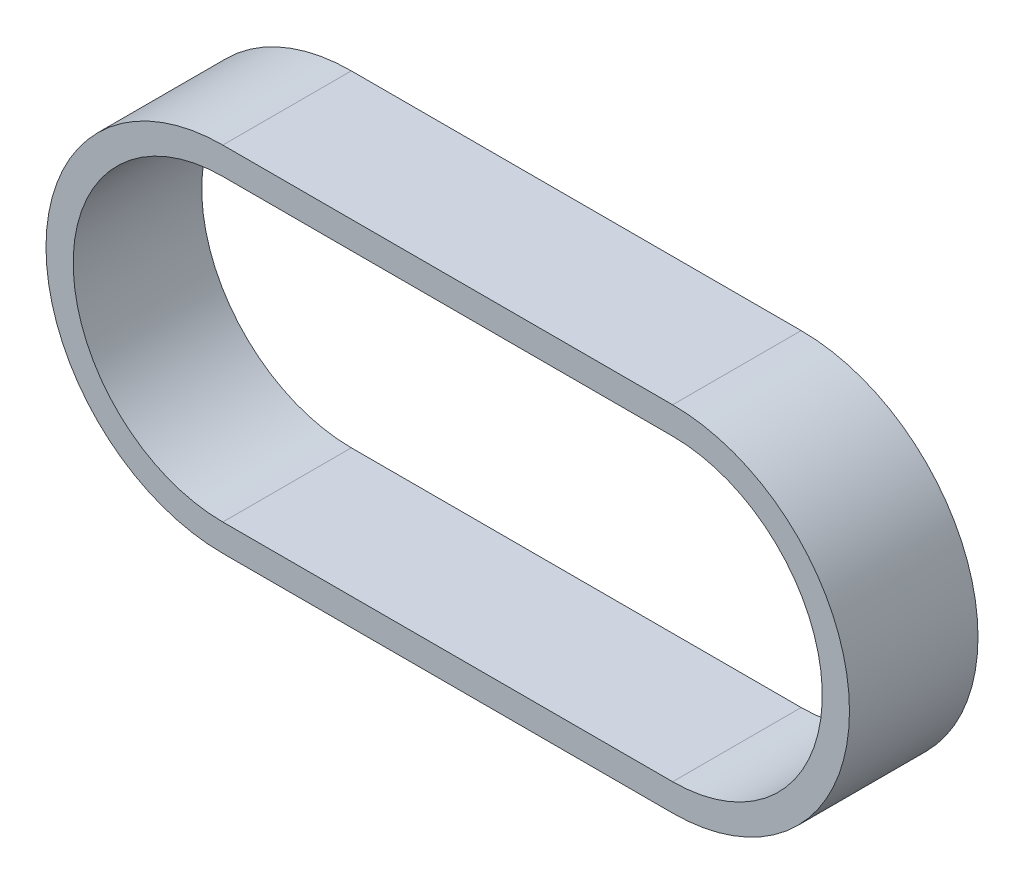
from build123d import *

# Parameters (mm, degrees)
BOSS_EXTRUDE1_DEPTH = 15


with BuildPart() as part:
    # Sketch1 → Boss-Extrude1 (new body)
    with BuildSketch(Plane.XY):
        with BuildLine():
            Line((0, 20.6375), (52.5018, 20.6375))
            ThreePointArc((52.5018, 20.6375), (73.1393, 0), (52.5018, -20.6375))
            Line((52.5018, -20.6375), (0, -20.6375))
            ThreePointArc((0, -20.6375), (-20.6375, 0), (0, 20.6375))
        make_face()
        with BuildLine():
            Line((0, 17.4625), (52.5018, 17.4625))
            ThreePointArc((52.5018, 17.4625), (69.9643, 0), (52.5018, -17.4625))
            Line((52.5018, -17.4625), (0, -17.4625))
            ThreePointArc((0, -17.4625), (-17.4625, 0), (0, 17.4625))
        make_face(mode=Mode.SUBTRACT)
    extrude(amount=BOSS_EXTRUDE1_DEPTH)


solid = part.part
